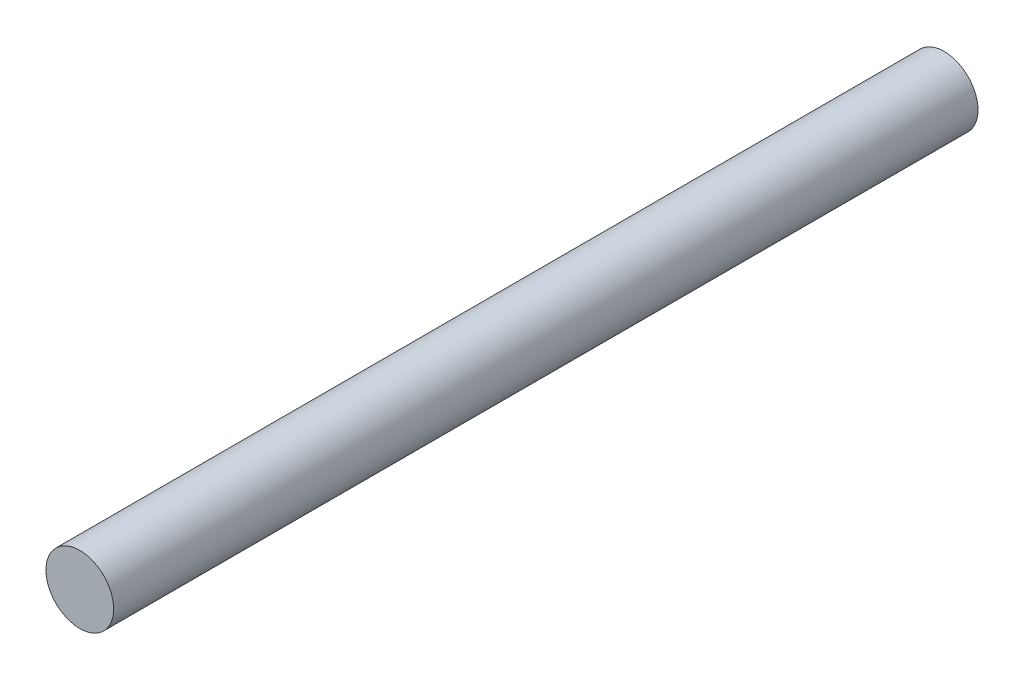
from build123d import *

# Parameters (mm, degrees)
SKETCH1_R           = 49.95
BOSS_EXTRUDE1_DEPTH = 1275


with BuildPart() as part:
    # Sketch1 → Boss-Extrude1 (new body)
    with BuildSketch(Plane.XY):
        Circle(SKETCH1_R)
    extrude(amount=BOSS_EXTRUDE1_DEPTH)


solid = part.part
